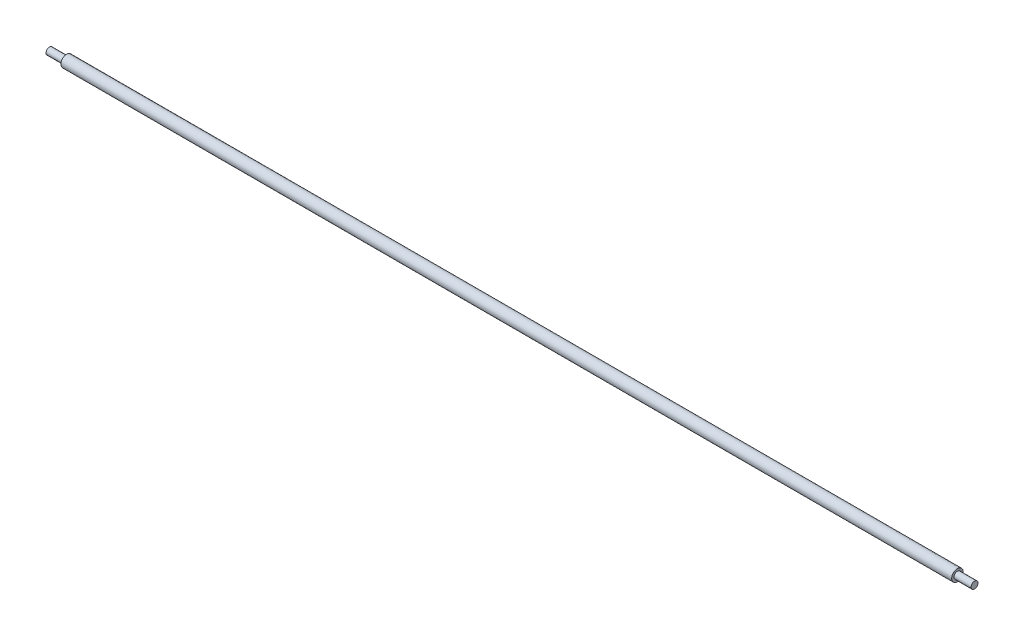
from build123d import *

# Parameters (mm, degrees)
EXTRUDE_1_DEPTH      = 508
EXTRUDE_1_DEPTH_BACK = 270
SKETCH_1_R           = 5
SKETCH_2_R           = 3
EXTRUDE_2_DEPTH      = 15
EXTRUDE_START        = 15
SKETCH_7_R           = 3
EXTRUDE_3_DEPTH      = 15


with BuildPart() as part:
    # Эскиз1 → Бобышка-Вытянуть1 (new, two sides: drawn at the far end of the back side and taken through both)
    with BuildSketch(Plane(origin=(0, 0, 0), x_dir=(0, 0, -1), z_dir=(1, 0, 0)).offset(-EXTRUDE_1_DEPTH_BACK)):
        Circle(SKETCH_1_R)
    extrude(amount=EXTRUDE_1_DEPTH + EXTRUDE_1_DEPTH_BACK)

    # Эскиз2 → Бобышка-Вытянуть2 (add)
    with BuildSketch(Plane.ZY.offset(270)):
        Circle(SKETCH_2_R)
    extrude(amount=EXTRUDE_2_DEPTH)

    # Эскиз7 → Бобышка-Вытянуть3 (add)
    with BuildSketch(Plane(origin=(508, 0, 0), x_dir=(0, 0, -1), z_dir=(1, 0, 0)).offset(EXTRUDE_START)):
        with Locations(Location((0, 0, 0), (0, 0, 180))):
            Circle(SKETCH_7_R)
    extrude(amount=-EXTRUDE_3_DEPTH)


solid = part.part
